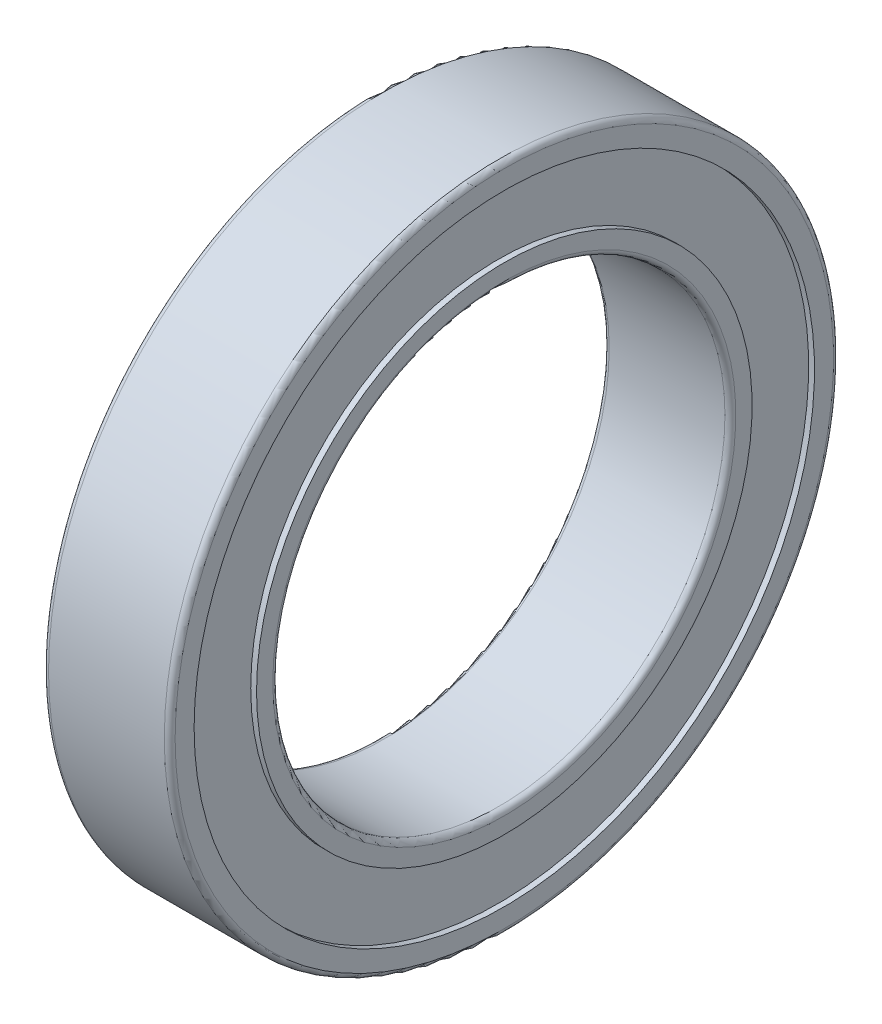
from build123d import *

# Parameters (mm, degrees)
FILLET1_R = 0.3
FILLET2_R = 0.3


with BuildPart() as part:
    # Sketch1 → Revolve1 (revolve)
    with BuildSketch(Plane.XY, mode=Mode.PRIVATE) as revolve1_sk:
        Polygon((0, 12.5), (7, 12.5), (7, 13.7), (6.68, 13.7), (6.68, 17.15), (7, 17.15), (7, 18.5), (0, 18.5), (0, 17.15), (0.32, 17.15), (0.32, 13.7), (0, 13.7), align=None)
    revolve(revolve1_sk.sketch.rotate(Axis((0, 0, 0), (1, 0, 0)), 90), axis=Axis((0, 0, 0), (1, 0, 0)))

    # Fillet1
    fillet1_edges = [part.edges().sort_by_distance(p)[0] for p in [
        (0, 0, -18.5),
        (7, 0, -18.5),
    ]]
    fillet(fillet1_edges, radius=FILLET1_R)

    # Fillet2
    fillet2_edges = [part.edges().sort_by_distance(p)[0] for p in [
        (7, 0, -12.5),
        (0, 0, -12.5),
    ]]
    fillet(fillet2_edges, radius=FILLET2_R)


solid = part.part
